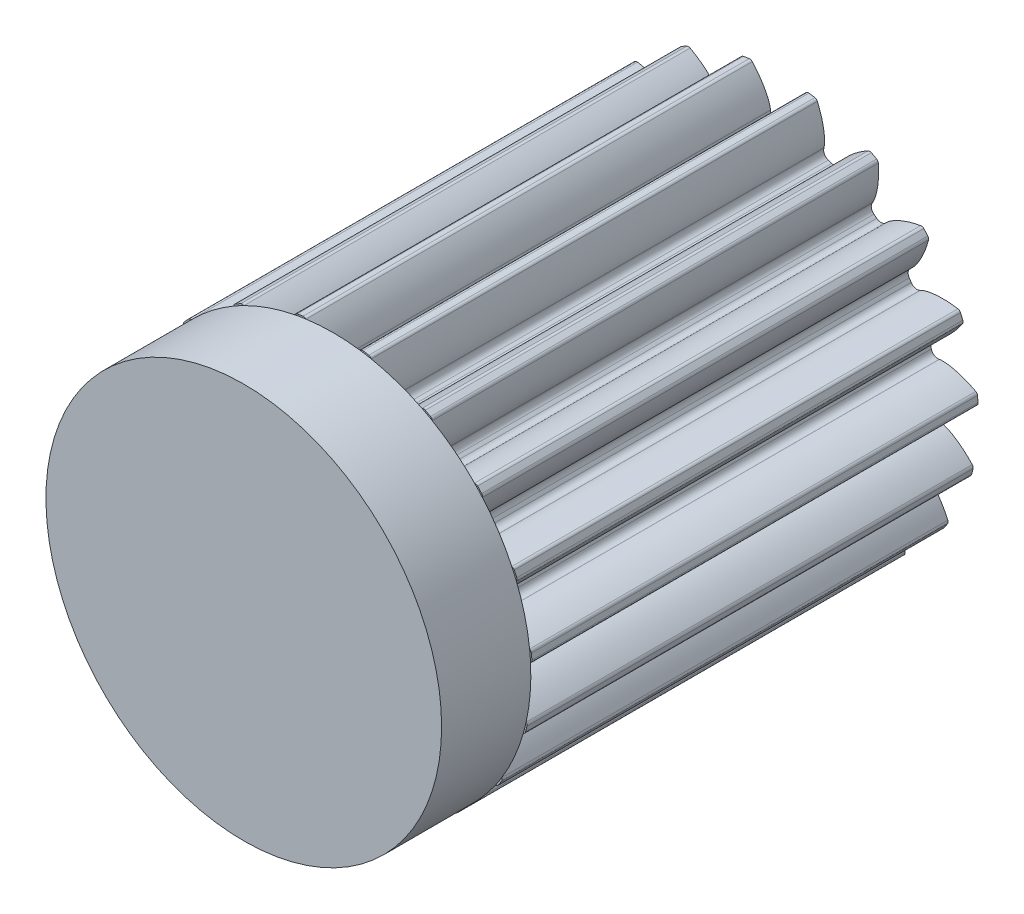
from build123d import *

# Parameters (mm, degrees)
SKETCH1_R                                 = 5.674468085
BOSS_EXTRUDE1_DEPTH                       = 12.7
CUT_EXTRUDE_DCLTBC_DEPTH                  = 16.022954972
FILLET_TIP_DCLTBC_R                       = 0.096102404
FILLET_ROOT_DCLTBC_R                      = 0.192204808
CIRPATTERN_DCLTBC_COUNT                   = 19
FILLET_TIP_DCLTBC_OF_CIRPATTERN_DCLTBC_R  = 0.096102404
FILLET_ROOT_DCLTBC_OF_CIRPATTERN_DCLTBC_R = 0.192204808
SKETCH4_R                                 = 5.63194408
BOSS_EXTRUDE2_DEPTH                       = 2.54


with BuildPart() as part:
    # Sketch1 → Boss-Extrude1 (new body)
    with BuildSketch(Plane.XY):
        Circle(SKETCH1_R)
    extrude(amount=BOSS_EXTRUDE1_DEPTH)

    # DCLTBC → Cut-Extrude-DCLTBC (cut, through all)
    with BuildSketch(Plane.XY):
        with BuildLine():
            Line((-0.245092193, 4.646563298), (-0.23484651, 4.452321218))
            ThreePointArc((-0.23484651, 4.452321218), (0, 4.458510638), (0.23484651, 4.452321218))
            Line((0.23484651, 4.452321218), (0.245092193, 4.646563298))
            add(Edge.make_bspline(
                [(0.245092193, 4.646563298), (0.245205198, 4.648235758), (0.245598625, 4.652921261), (0.246644301, 4.661756562), (0.248778336, 4.676129962), (0.252125019, 4.694371372), (0.25716906, 4.717849209), (0.264032206, 4.745363395), (0.272535997, 4.775431546), (0.282820603, 4.807941973), (0.293990643, 4.84018149), (0.30597585, 4.872146708), (0.318672458, 4.903803641), (0.334942068, 4.941915841), (0.355685271, 4.987280163), (0.381714036, 5.039774551), (0.41332803, 5.098655457), (0.447761491, 5.15790888), (0.4834556, 5.215574779), (0.521575174, 5.273050889), (0.559913095, 5.328100194), (0.601804509, 5.384410339), (0.641528777, 5.435949691), (0.688289153, 5.492672894), (0.726687126, 5.538156126), (0.768206749, 5.584252413), (0.788686934, 5.606554975), (0.79926778, 5.61789632)],
                knots=[0, 0, 0, 0, 0, 0.005376749, 0.015083688, 0.02853182, 0.04661014, 0.064854849, 0.092110525, 0.119476176, 0.146842496, 0.174208854, 0.201574956, 0.228941013, 0.256307345, 0.307035032, 0.361767352, 0.416499661, 0.471231937, 0.525964282, 0.580696616, 0.635428982, 0.690161387, 0.744893688, 0.799626082, 0.854358408, 0.909090915, 0.909090915, 0.909090915, 0.909090915, 0.909090915], degree=4))
            ThreePointArc((0.79926778, 5.61789632), (0, 5.674468085), (-0.79926778, 5.61789632))
            add(Edge.make_bspline(
                [(-0.245092193, 4.646563298), (-0.245205198, 4.648235758), (-0.245598625, 4.652921261), (-0.246644301, 4.661756562), (-0.248778336, 4.676129962), (-0.252125019, 4.694371372), (-0.25716906, 4.717849209), (-0.264032206, 4.745363395), (-0.272535997, 4.775431546), (-0.282820603, 4.807941973), (-0.293990643, 4.84018149), (-0.30597585, 4.872146708), (-0.318672458, 4.903803641), (-0.334942068, 4.941915841), (-0.355685271, 4.987280163), (-0.381714036, 5.039774551), (-0.41332803, 5.098655457), (-0.447761491, 5.15790888), (-0.4834556, 5.215574779), (-0.521575174, 5.273050889), (-0.559913095, 5.328100194), (-0.601804509, 5.384410339), (-0.641528777, 5.435949691), (-0.688289153, 5.492672894), (-0.726687126, 5.538156126), (-0.768206749, 5.584252413), (-0.788686934, 5.606554975), (-0.79926778, 5.61789632)],
                knots=[0, 0, 0, 0, 0, 0.005376749, 0.015083688, 0.02853182, 0.04661014, 0.064854849, 0.092110525, 0.119476176, 0.146842496, 0.174208854, 0.201574956, 0.228941013, 0.256307345, 0.307035032, 0.361767352, 0.416499661, 0.471231937, 0.525964282, 0.580696616, 0.635428982, 0.690161387, 0.744893688, 0.799626082, 0.854358408, 0.909090915, 0.909090915, 0.909090915, 0.909090915, 0.909090915], degree=4))
        make_face()
    cut_extrude_dcltbc = extrude(amount=CUT_EXTRUDE_DCLTBC_DEPTH, mode=Mode.SUBTRACT)

    # Fillet-Tip-DCLTBC
    fillet_tip_dcltbc_edges = [part.edges().sort_by_distance(p)[0] for p in [
        (0.79926778, 5.61789632, 6.35),
        (-0.79926778, 5.61789632, 6.35),
    ]]
    fillet(fillet_tip_dcltbc_edges, radius=FILLET_TIP_DCLTBC_R)

    # Fillet-Root-DCLTBC
    fillet_root_dcltbc_edges = [part.edges().sort_by_distance(p)[0] for p in [
        (0.23484651, 4.452321218, 6.35),
        (-0.23484651, 4.452321218, 6.35),
    ]]
    fillet(fillet_root_dcltbc_edges, radius=FILLET_ROOT_DCLTBC_R)

    # CirPattern-DCLTBC: Cut-Extrude-DCLTBC ×19 about axis
    cirpattern_dcltbc_axis = Axis((0, 0, 12.7), (0, 0, 1))
    for i in range(1, CIRPATTERN_DCLTBC_COUNT):
        add(cut_extrude_dcltbc.rotate(cirpattern_dcltbc_axis, i * 360 / CIRPATTERN_DCLTBC_COUNT), mode=Mode.SUBTRACT)

    # Fillet-Tip-DCLTBC of CirPattern-DCLTBC
    fillet_tip_dcltbc_of_cirpattern_dcltbc_edges = [part.edges().sort_by_distance(p)[0] for p in [
        (-1.068166706, 5.573025026, 6.35),
        (-2.580089201, 5.053981378, 6.35),
        (-2.819848755, 4.924229995, 6.35),
        (-4.081317922, 3.942389132, 6.35),
        (-4.265956437, 3.741818238, 6.35),
        (-5.140272518, 2.403577852, 6.35),
        (-5.249781546, 2.153922414, 6.35),
        (-5.642198827, 0.604301616, 6.35),
        (-5.664711366, 0.332615675, 6.35),
        (-5.532705346, -1.260460077, 6.35),
        (-5.465781812, -1.524735134, 6.35),
        (-4.823657392, -2.988631362, 6.35),
        (-4.674549989, -3.216857232, 6.35),
        (-3.591891312, -4.392938066, 6.35),
        (-3.376758141, -4.560382934, 6.35),
        (-1.970888075, -5.321201767, 6.35),
        (-1.713042153, -5.409720384, 6.35),
        (-0.136308534, -5.67283069, 6.35),
        (0.136308534, -5.67283069, 6.35),
        (1.713042153, -5.409720384, 6.35),
        (1.970888075, -5.321201767, 6.35),
        (3.376758141, -4.560382934, 6.35),
        (3.591891312, -4.392938066, 6.35),
        (4.674549989, -3.216857232, 6.35),
        (4.823657392, -2.988631362, 6.35),
        (5.465781812, -1.524735134, 6.35),
        (5.532705346, -1.260460077, 6.35),
        (5.664711366, 0.332615675, 6.35),
        (5.642198827, 0.604301616, 6.35),
        (5.249781546, 2.153922414, 6.35),
        (5.140272518, 2.403577852, 6.35),
        (4.265956437, 3.741818238, 6.35),
        (4.081317922, 3.942389132, 6.35),
        (2.819848755, 4.924229995, 6.35),
        (2.580089201, 5.053981378, 6.35),
        (1.068166706, 5.573025026, 6.35),
    ]]
    fillet(fillet_tip_dcltbc_of_cirpattern_dcltbc_edges, radius=FILLET_TIP_DCLTBC_OF_CIRPATTERN_DCLTBC_R)

    # Fillet-Root-DCLTBC of CirPattern-DCLTBC
    fillet_root_dcltbc_of_cirpattern_dcltbc_edges = [part.edges().sort_by_distance(p)[0] for p in [
        (-1.223544458, 4.287336711, 6.35),
        (-1.667788214, 4.134827637, 6.35),
        (-2.549345399, 3.657752746, 6.35),
        (-2.919999187, 3.369261322, 6.35),
        (-3.598885208, 2.631794515, 6.35),
        (-3.85578294, 2.238583264, 6.35),
        (-4.258429963, 1.320640512, 6.35),
        (-4.373732783, 0.865319974, 6.35),
        (-4.456507755, -0.133625382, 6.35),
        (-4.417720813, -0.601714162, 6.35),
        (-4.171653782, -1.573410893, 6.35),
        (-3.982980245, -2.003543232, 6.35),
        (-3.434736391, -2.842692919, 6.35),
        (-3.116621965, -3.188257304, 6.35),
        (-2.325612017, -3.803925059, 6.35),
        (-1.912529336, -4.027474227, 6.35),
        (-0.964471496, -4.352942895, 6.35),
        (-0.501184477, -4.430251825, 6.35),
        (0.501184477, -4.430251825, 6.35),
        (0.964471496, -4.352942895, 6.35),
        (1.912529336, -4.027474227, 6.35),
        (2.325612017, -3.803925059, 6.35),
        (3.116621965, -3.188257304, 6.35),
        (3.434736391, -2.842692919, 6.35),
        (3.982980245, -2.003543232, 6.35),
        (4.171653782, -1.573410893, 6.35),
        (4.417720813, -0.601714162, 6.35),
        (4.456507755, -0.133625382, 6.35),
        (4.373732783, 0.865319974, 6.35),
        (4.258429963, 1.320640512, 6.35),
        (3.85578294, 2.238583264, 6.35),
        (3.598885208, 2.631794515, 6.35),
        (2.919999187, 3.369261322, 6.35),
        (2.549345399, 3.657752746, 6.35),
        (1.667788214, 4.134827637, 6.35),
        (1.223544458, 4.287336711, 6.35),
    ]]
    fillet(fillet_root_dcltbc_of_cirpattern_dcltbc_edges, radius=FILLET_ROOT_DCLTBC_OF_CIRPATTERN_DCLTBC_R)

    # Sketch4 → Boss-Extrude2 (add)
    with BuildSketch(Plane.XY.offset(12.7)):
        with Locations(Location((0, 0, 0), (0, 0, 176.936536479))):
            Circle(SKETCH4_R)
    extrude(amount=BOSS_EXTRUDE2_DEPTH)


solid = part.part
